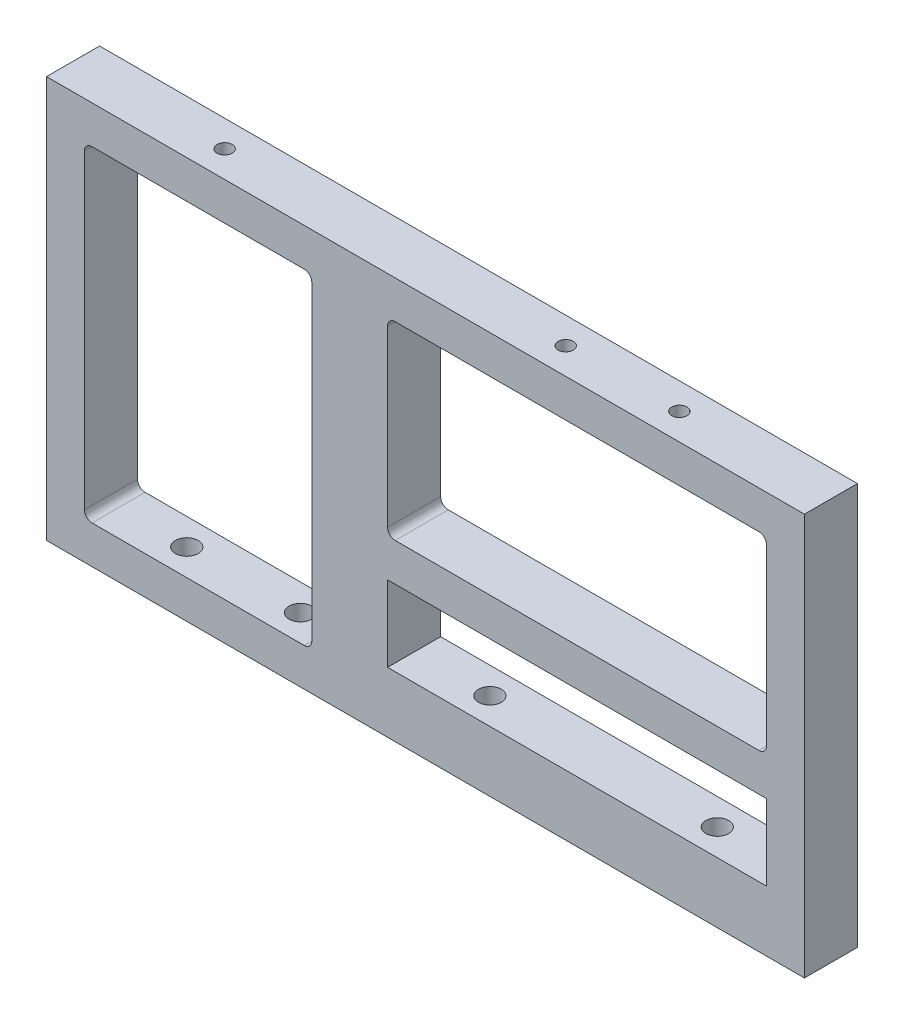
from build123d import *

# Parameters (mm, degrees)
SKETCH_1_W          = 100
SKETCH_1_H          = 53
SKETCH_1_W_2        = 30
SKETCH_1_H_2        = 43
SKETCH_1_W_3        = 50
SKETCH_1_H_3        = 25
SKETCH_1_H_4        = 10
EXTRUDE_1_DEPTH     = 7
FILLET_1_R          = 1
CUT_EXTRUDE_2_REACH = 115.393
SKETCH_2_R          = 1.5
SKETCH_3_R          = 1
CUT_EXTRUDE_3_DEPTH = 5


with BuildPart() as part:
    # 草图1 → 凸台-拉伸1 (new body)
    with BuildSketch(Plane.XY):
        with Locations((50, 26.5)):
            Rectangle(SKETCH_1_W, SKETCH_1_H)
        with Locations((20, 26.5)):
            Rectangle(SKETCH_1_W_2, SKETCH_1_H_2, mode=Mode.SUBTRACT)
        with Locations((70, 35.5)):
            Rectangle(SKETCH_1_W_3, SKETCH_1_H_3, mode=Mode.SUBTRACT)
        with Locations((70, 13)):
            Rectangle(SKETCH_1_W_3, SKETCH_1_H_4, mode=Mode.SUBTRACT)
    extrude(amount=EXTRUDE_1_DEPTH)

    # 圆角1
    fillet_1_edges = [part.edges().sort_by_distance(p)[0] for p in [
        (35, 48, 3.5),
        (5, 48, 3.5),
        (5, 5, 3.5),
        (35, 5, 3.5),
        (95, 48, 3.5),
        (45, 48, 3.5),
        (45, 23, 3.5),
        (95, 23, 3.5),
    ]]
    fillet(fillet_1_edges, radius=FILLET_1_R)

    # 草图2 → 切除-拉伸2 (cut, up to next)
    with BuildSketch(Plane.XZ, mode=Mode.PRIVATE) as cut_extrude_2_sk1:
        with Locations(Location((15, 3.5, 0), (0, 0, 270))):
            Circle(SKETCH_2_R)
    cut_extrude_2_tool1 = extrude(cut_extrude_2_sk1.sketch, amount=-CUT_EXTRUDE_2_REACH, mode=Mode.PRIVATE) & part.part
    # 草图2 → 切除-拉伸2 (cut, up to next)
    with BuildSketch(Plane.XZ, mode=Mode.PRIVATE) as cut_extrude_2_sk2:
        with Locations(Location((85, 3.5, 0), (0, 0, 270))):
            Circle(SKETCH_2_R)
    cut_extrude_2_tool2 = extrude(cut_extrude_2_sk2.sketch, amount=-CUT_EXTRUDE_2_REACH, mode=Mode.PRIVATE) & part.part
    # 草图2 → 切除-拉伸2 (cut, up to next)
    with BuildSketch(Plane.XZ, mode=Mode.PRIVATE) as cut_extrude_2_sk3:
        with Locations(Location((55, 3.5, 0), (0, 0, 270))):
            Circle(SKETCH_2_R)
    cut_extrude_2_tool3 = extrude(cut_extrude_2_sk3.sketch, amount=-CUT_EXTRUDE_2_REACH, mode=Mode.PRIVATE) & part.part
    # 草图2 → 切除-拉伸2 (cut, up to next)
    with BuildSketch(Plane.XZ, mode=Mode.PRIVATE) as cut_extrude_2_sk4:
        with Locations(Location((30, 3.5, 0), (0, 0, 270))):
            Circle(SKETCH_2_R)
    cut_extrude_2_tool4 = extrude(cut_extrude_2_sk4.sketch, amount=-CUT_EXTRUDE_2_REACH, mode=Mode.PRIVATE) & part.part
    add(cut_extrude_2_tool1.solids().sort_by_distance((15, 0, 3.5))[0], mode=Mode.SUBTRACT)
    add(cut_extrude_2_tool2.solids().sort_by_distance((85, 0, 3.5))[0], mode=Mode.SUBTRACT)
    add(cut_extrude_2_tool3.solids().sort_by_distance((55, 0, 3.5))[0], mode=Mode.SUBTRACT)
    add(cut_extrude_2_tool4.solids().sort_by_distance((30, 0, 3.5))[0], mode=Mode.SUBTRACT)

    # 草图3 → 切除-拉伸3 (cut)
    with BuildSketch(Plane(origin=(0, 53, 0), x_dir=(1, 0, 0), z_dir=(0, 1, 0))):
        with Locations(Location((80, -3.5, 0), (0, 0, 180))):
            Circle(SKETCH_3_R)
        with Locations(Location((65, -3.5, 0), (0, 0, 180))):
            Circle(SKETCH_3_R)
        with Locations(Location((20, -3.5, 0), (0, 0, 180))):
            Circle(SKETCH_3_R)
    extrude(amount=-CUT_EXTRUDE_3_DEPTH, mode=Mode.SUBTRACT)


solid = part.part
